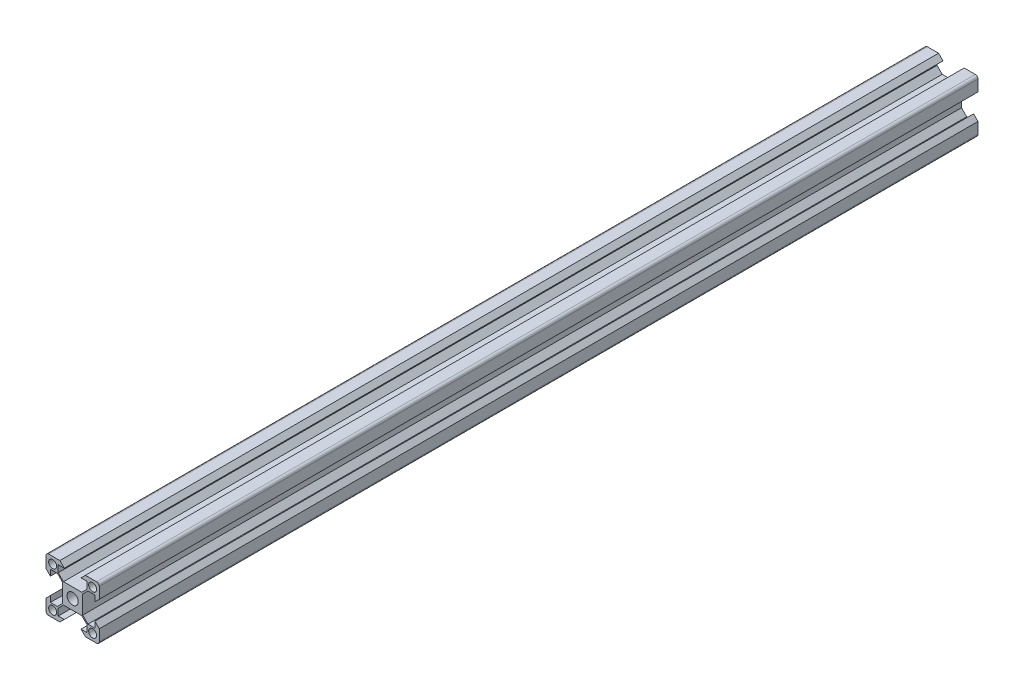
from build123d import *

# Parameters (mm, degrees)
SKETCH_1_R      = 1.5
SKETCH_1_R_2    = 2.1
EXTRUDE_1_DEPTH = 165
FILLET_1_R      = 1


with BuildPart() as part:
    # 草图1 → 凸台-拉伸1 (new, symmetric)
    with BuildSketch(Plane.XY):
        Polygon((-10, 10), (-10, 4.8), (-8.34, 3.14), (-8.34, 5.4), (-5.753553391, 5.4), (-3.8, 3.446446609), (-3.8, -3.446446609), (-5.753553391, -5.4), (-8.34, -5.4), (-8.34, -3.14), (-10, -4.8), (-10, -10), (-4.8, -10), (-3.14, -8.34), (-5.4, -8.34), (-5.4, -5.753553391), (-3.446446609, -3.8), (3.446446609, -3.8), (5.4, -5.753553391), (5.4, -8.34), (3.14, -8.34), (4.8, -10), (10, -10), (10, -4.8), (8.34, -3.14), (8.34, -5.4), (5.753553391, -5.4), (3.8, -3.446446609), (3.8, 3.446446609), (5.753553391, 5.4), (8.34, 5.4), (8.34, 3.14), (10, 4.8), (10, 10), (4.8, 10), (3.14, 8.34), (5.4, 8.34), (5.4, 5.753553391), (3.446446609, 3.8), (-3.446446609, 3.8), (-5.4, 5.753553391), (-5.4, 8.34), (-3.14, 8.34), (-4.8, 10), align=None)
        with Locations((-7.5, 7.5)):
            Circle(SKETCH_1_R, mode=Mode.SUBTRACT)
        Circle(SKETCH_1_R_2, mode=Mode.SUBTRACT)
        with Locations(Location((-7.5, -7.5, 0), (0, 0, 180))):
            Circle(SKETCH_1_R, mode=Mode.SUBTRACT)
        with Locations((7.5, -7.5)):
            Circle(SKETCH_1_R, mode=Mode.SUBTRACT)
        with Locations(Location((7.5, 7.5, 0), (0, 0, 180))):
            Circle(SKETCH_1_R, mode=Mode.SUBTRACT)
    extrude(amount=EXTRUDE_1_DEPTH, both=True)

    # 圆角1
    fillet_1_edges = [part.edges().sort_by_distance(p)[0] for p in [
        (10, 10, 0),
        (10, -10, 0),
        (-10, -10, 0),
        (-10, 10, 0),
    ]]
    fillet(fillet_1_edges, radius=FILLET_1_R)


solid = part.part
